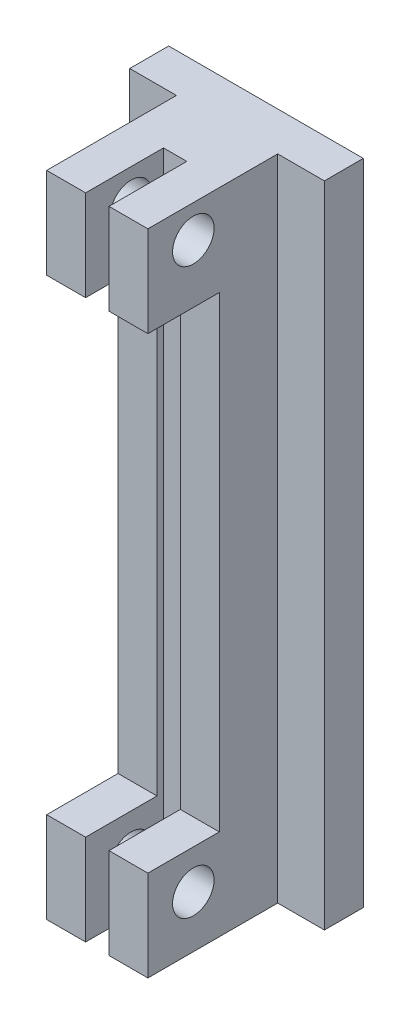
from build123d import *

# Parameters (mm, degrees)
BOSS_EXTRUDE1_DEPTH = 25
SKETCH2_W           = 5.5
SKETCH2_H           = 36
CUT_EXTRUDE1_DEPTH  = 31.396710348
SKETCH3_R           = 1.6
CUT_EXTRUDE2_DEPTH  = 31.396710348


with BuildPart() as part:
    # Sketch1 → Boss-Extrude1 (new, symmetric)
    with BuildSketch(Plane(origin=(0, 0, 0), x_dir=(1, 0, 0), z_dir=(0, 1, 0))):
        Polygon((7.5, 0), (-7.5, 0), (-7.5, -3), (-3.9, -3), (-3.9, -13), (-0.9, -13), (-0.9, -7), (0.9, -7), (0.9, -13), (3.9, -13), (3.9, -3), (7.5, -3), align=None)
    extrude(amount=BOSS_EXTRUDE1_DEPTH, both=True)

    # Sketch2 → Cut-Extrude1 (cut, through all)
    with BuildSketch(Plane.ZY.offset(3.9)):
        with Locations((10.25, 0)):
            Rectangle(SKETCH2_W, SKETCH2_H)
    extrude(amount=-CUT_EXTRUDE1_DEPTH, mode=Mode.SUBTRACT)

    # Sketch3 → Cut-Extrude2 (cut, through all)
    with BuildSketch(Plane.ZY.offset(3.9)):
        with Locations((9.5, 22.5)):
            Circle(SKETCH3_R)
        with Locations((9.5, -21)):
            Circle(SKETCH3_R)
    extrude(amount=-CUT_EXTRUDE2_DEPTH, mode=Mode.SUBTRACT)


solid = part.part
